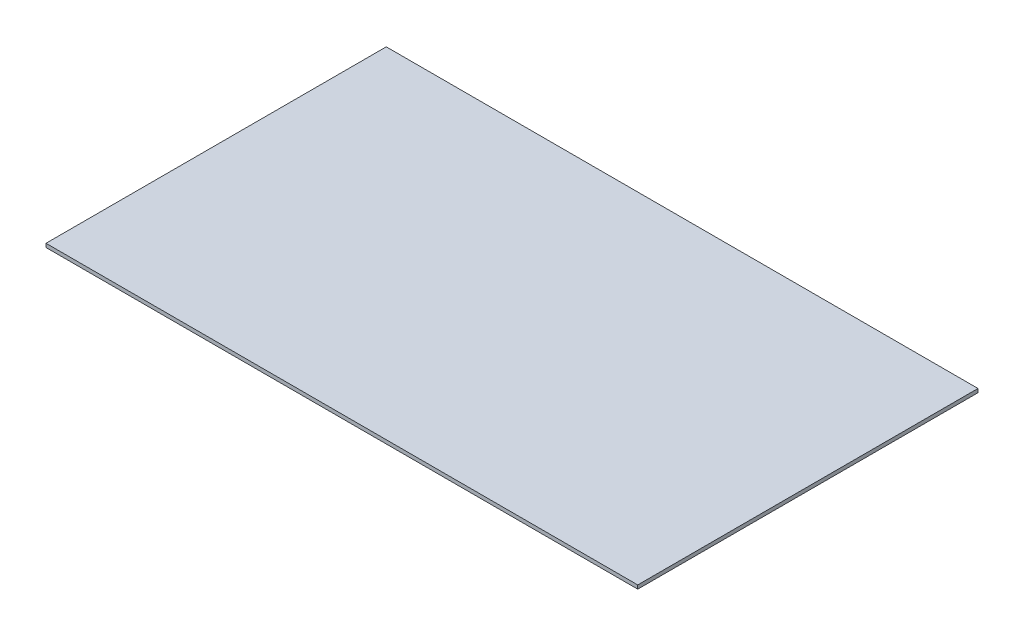
from build123d import *

# Parameters (mm, degrees)
SKETCH1_W           = 254
SKETCH1_H           = 146.05
BOSS_EXTRUDE1_DEPTH = 1.5875


with BuildPart() as part:
    # Sketch1 → Boss-Extrude1 (new body)
    with BuildSketch(Plane(origin=(0, 0, 0), x_dir=(1, 0, 0), z_dir=(0, 1, 0))):
        with Locations((28.352192982, 0.320285088)):
            Rectangle(SKETCH1_W, SKETCH1_H)
    extrude(amount=BOSS_EXTRUDE1_DEPTH)


solid = part.part
